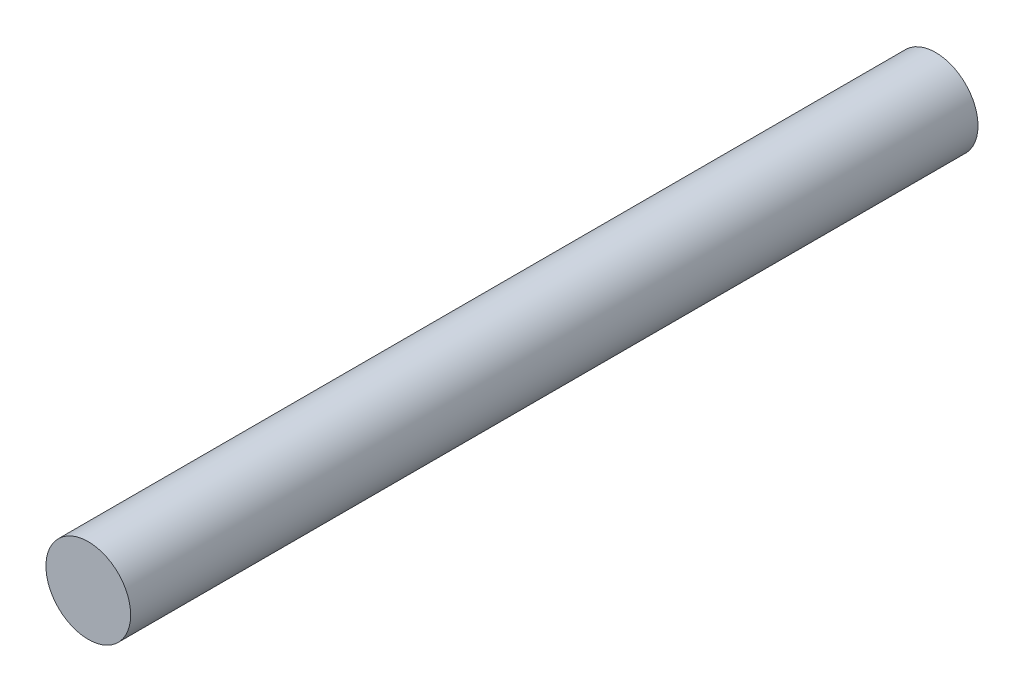
from build123d import *

# Parameters (mm, degrees)
ESQUISSE1_R        = 2.5
BOSS_EXTRU_1_DEPTH = 50


with BuildPart() as part:
    # Esquisse1 → Boss.-Extru.1 (new body)
    with BuildSketch(Plane.XY):
        Circle(ESQUISSE1_R)
    extrude(amount=BOSS_EXTRU_1_DEPTH)


solid = part.part
